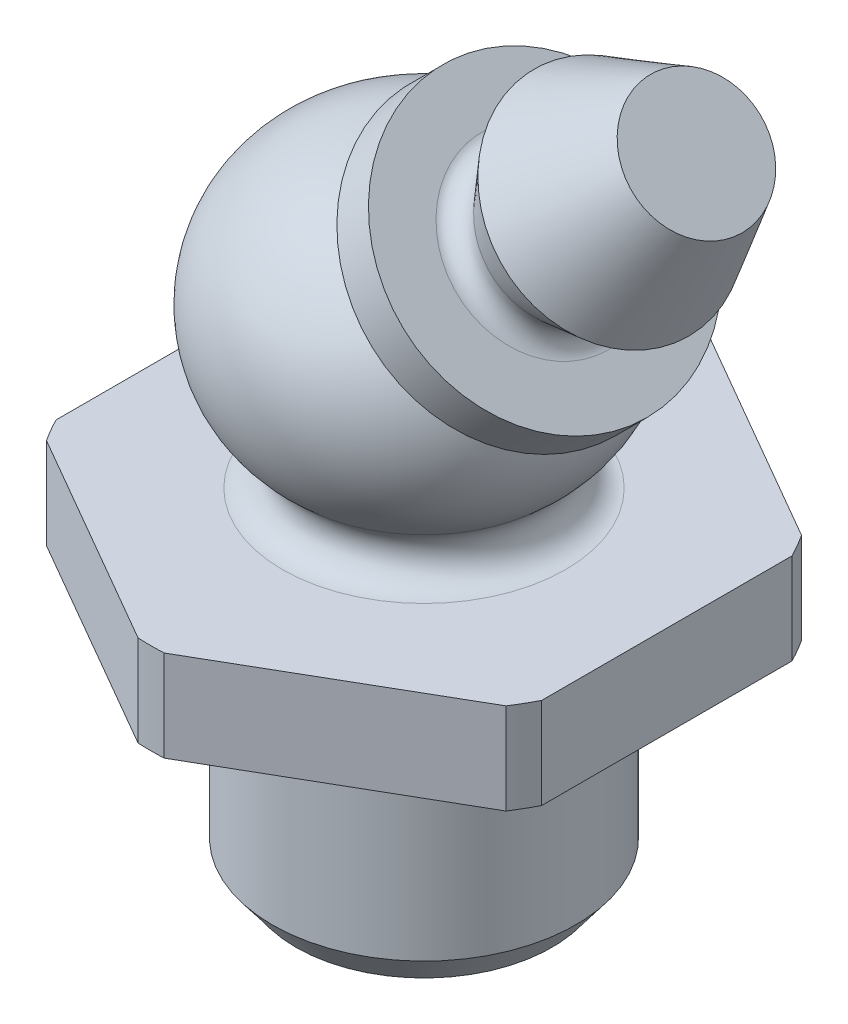
from build123d import *

# Parameters (mm, degrees)
SKETCH_5_OUTSIDE_W  = 26.6
SKETCH_5_OUTSIDE_H  = 26.6
CUT_EXTRUDE_1_DEPTH = 134.94571279


with BuildPart() as part:
    # 草图2 → 旋转1 (revolve)
    with BuildSketch(Plane.XY, mode=Mode.PRIVATE) as revolve_1_sk:
        with BuildLine():
            Line((124.996034131, 120.605813119), (124.189541537, 120.605813119))
            Line((124.189541537, 120.605813119), (124.189541537, 99.605813119))
            Line((124.189541537, 99.605813119), (128.408588613, 99.605813119))
            Line((128.408588613, 99.605813119), (129.189541537, 100.63919496))
            Line((129.189541537, 100.63919496), (129.189541537, 107.605813119))
            Line((129.189541537, 107.605813119), (133.189541537, 107.605813119))
            Line((133.189541537, 107.605813119), (133.189541537, 110.605813119))
            Line((133.189541537, 110.605813119), (128.853577909, 110.605813119))
            ThreePointArc((128.853577909, 110.605813119), (128.024232739, 111.188302984), (128.290749921, 112.166094601))
            ThreePointArc((128.290749921, 112.166094601), (129.689863315, 117.57524199), (124.996034131, 120.605813119))
        make_face()
    revolve(revolve_1_sk.sketch.rotate(Axis((124.189541537, 120.605813119, 0), (0, -1, 0)), 90), axis=Axis((124.189541537, 120.605813119, 0), (0, -1, 0)))

    # 草图5 outside → 切除-拉伸1 (cut, through all)
    with BuildSketch(Plane(origin=(0, 110.605813119, 0), x_dir=(1, 0, 0), z_dir=(0, 1, 0))):
        with Locations((124.19, 0)):
            Rectangle(SKETCH_5_OUTSIDE_W, SKETCH_5_OUTSIDE_H)
        Polygon((124.189541537, 9.237604307), (132.189541537, 4.618802154), (132.189541537, -4.618802154), (124.189541537, -9.237604307), (116.189541537, -4.618802154), (116.189541537, 4.618802154), align=None, mode=Mode.SUBTRACT)
    extrude(amount=-CUT_EXTRUDE_1_DEPTH, mode=Mode.SUBTRACT)

    # 草图6 → 旋转2 (revolve)
    with BuildSketch(Plane.XY, mode=Mode.PRIVATE) as revolve_2_sk:
        with BuildLine():
            Line((133.163968864, 124.631412982), (131.656069582, 126.139312264))
            Line((131.656069582, 126.139312264), (127.824956174, 124.376904464))
            Line((127.824956174, 124.376904464), (127.073314038, 121.958157384))
            ThreePointArc((127.073314038, 121.958157384), (126.655554411, 121.564442646), (126.102557912, 121.718485734))
            Line((126.102557912, 121.718485734), (124.8176438, 123.003399846))
            Line((124.8176438, 123.003399846), (123.778101502, 121.963857549))
            Line((123.778101502, 121.963857549), (127.137257467, 118.604701585))
            Line((127.137257467, 118.604701585), (133.163968864, 124.631412982))
        make_face()
    revolve(revolve_2_sk.sketch.rotate(Axis((124.555886728, 116.023330846, 0), (0.7071067811865461, 0.707106781186549, 0)), 180), axis=Axis((124.555886728, 116.023330846, 0), (0.7071067811865461, 0.707106781186549, 0)))


solid = part.part
